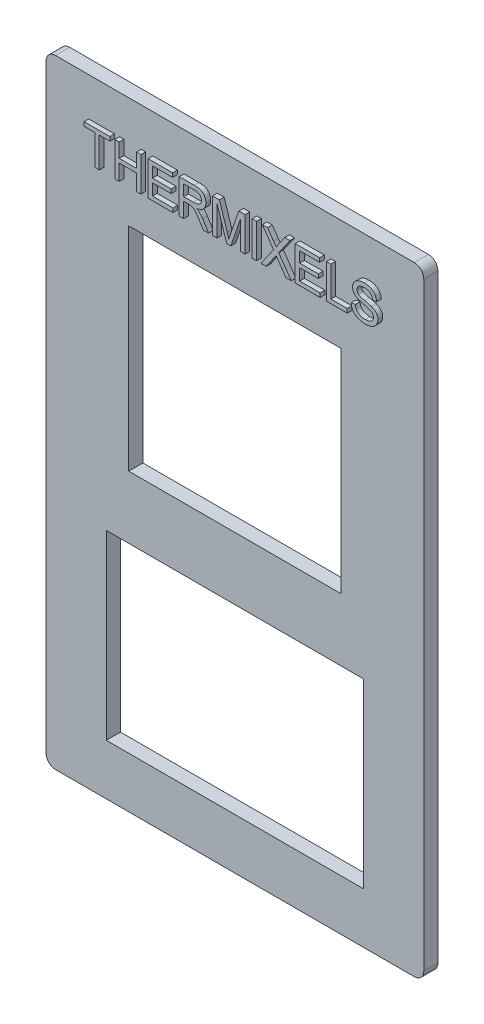
from build123d import *

# Parameters (mm, degrees)
SKETCH1_W           = 80
SKETCH1_H           = 131
SKETCH1_W_2         = 45
SKETCH1_H_2         = 45
SKETCH1_W_3         = 54.5
SKETCH1_H_3         = 38.5
BOSS_EXTRUDE1_DEPTH = 3
SKETCH2_W           = 0.941558442
SKETCH2_H           = 7.25
BOSS_EXTRUDE2_DEPTH = 1
FILLET1_R           = 2


with BuildPart() as part:
    # Sketch1 → Boss-Extrude1 (new body)
    with BuildSketch(Plane.XY):
        with Locations((40, 65.5)):
            Rectangle(SKETCH1_W, SKETCH1_H)
        with Locations((40, 85)):
            Rectangle(SKETCH1_W_2, SKETCH1_H_2, mode=Mode.SUBTRACT)
        with Locations((40, 30)):
            Rectangle(SKETCH1_W_3, SKETCH1_H_3, mode=Mode.SUBTRACT)
    extrude(amount=BOSS_EXTRUDE1_DEPTH)

    # Sketch2 → Boss-Extrude2 (add)
    # profile 1 of 10: a face of its own
    with BuildSketch(Plane.XY.offset(3)):
        Polygon((11.313135408, 115.625), (11.313135408, 122.027597403), (9.053395148, 122.027597403), (9.053395148, 122.875), (14.514434109, 122.875), (14.514434109, 122.027597403), (12.254693849, 122.027597403), (12.254693849, 115.625), align=None)
    # profile 2 of 10: a face of its own
    with BuildSketch(Plane.XY.offset(3)):
        Polygon((15.550148395, 115.625), (15.550148395, 122.875), (16.491706836, 122.875), (16.491706836, 119.862012987), (20.163784758, 119.862012987), (20.163784758, 122.875), (21.1053432, 122.875), (21.1053432, 115.625), (20.163784758, 115.625), (20.163784758, 119.01461039), (16.491706836, 119.01461039), (16.491706836, 115.625), align=None)
    # profile 3 of 10: a face of its own
    with BuildSketch(Plane.XY.offset(3)):
        Polygon((22.611836706, 115.625), (22.611836706, 122.875), (27.790408135, 122.875), (27.790408135, 122.027597403), (23.553395148, 122.027597403), (23.553395148, 119.767857143), (27.507940603, 119.767857143), (27.507940603, 118.920454545), (23.553395148, 118.920454545), (23.553395148, 116.472402597), (27.884563979, 116.472402597), (27.884563979, 115.625), align=None)
    # profile 4 of 10: a face of its own
    with BuildSketch(Plane.XY.offset(3)):
        with BuildLine():
            Line((29.202745797, 115.625), (29.202745797, 122.875))
            Line((29.202745797, 122.875), (32.336369986, 122.875))
            add(Edge.make_bspline(
                [(32.336369986, 122.875), (32.415336241, 122.874602612), (32.568437832, 122.873832148), (32.789716649, 122.863199873), (32.995291083, 122.847074214), (33.184490929, 122.826114805), (33.357685473, 122.796190369), (33.514545114, 122.761674794), (33.655985454, 122.720801194), (33.82183071, 122.656308753), (34.011369632, 122.55524165), (34.217224196, 122.40071533), (34.398971082, 122.209028701), (34.558679598, 121.987863894), (34.689761441, 121.739707682), (34.78440633, 121.469152962), (34.841431574, 121.179142079), (34.848485244, 120.979393902), (34.852096447, 120.877130682)],
                knots=[0, 0, 0, 0, 1.030544332, 1.998043051, 2.890480458, 3.721695405, 4.481404597, 5.183263541, 5.817161953, 6.400757953, 7.50313325, 8.609125791, 9.745318953, 10.937272591, 12.159766252, 13.39456301, 14.666118619, 16, 16, 16, 16], degree=3))
            add(Edge.make_bspline(
                [(34.852096447, 120.877130682), (34.850878894, 120.809379798), (34.848497722, 120.676879226), (34.824117737, 120.48292724), (34.785434685, 120.29888362), (34.727967971, 120.125077427), (34.658726792, 119.95998509), (34.570351593, 119.805660484), (34.467377381, 119.660766081), (34.34729021, 119.526869078), (34.213787663, 119.403076588), (34.064528058, 119.291763291), (33.901330769, 119.1921966), (33.72368519, 119.103606478), (33.532359455, 119.027044423), (33.325817908, 118.964419465), (33.105864621, 118.910925085), (32.952997363, 118.886081301), (32.874823719, 118.873376623)],
                knots=[0, 0, 0, 0, 1.04266252, 2.039137685, 3.004725552, 3.933568567, 4.853623551, 5.756445818, 6.665780382, 7.585649453, 8.520732132, 9.464553523, 10.447433731, 11.46044915, 12.517636968, 13.616238581, 14.780986072, 16, 16, 16, 16], degree=3))
            add(Edge.make_bspline(
                [(32.874823719, 118.873376623), (32.933067193, 118.846163831), (33.043243048, 118.794686946), (33.194496006, 118.710006913), (33.32486613, 118.626170358), (33.40005293, 118.564126927), (33.435345229, 118.535004058)],
                knots=[0, 0, 0, 0, 1.173923048, 2.22064321, 3.164779041, 4, 4, 4, 4], degree=3))
            add(Edge.make_bspline(
                [(33.435345229, 118.535004058), (33.503922314, 118.464223571), (33.641293629, 118.322438473), (33.831300043, 118.094708576), (34.01308525, 117.858295766), (34.121074074, 117.690848482), (34.175351317, 117.606686282)],
                knots=[0, 0, 0, 0, 0.993850212, 1.990847395, 2.990161568, 4, 4, 4, 4], degree=3))
            Line((34.175351317, 117.606686282), (35.417031512, 115.625))
            Line((35.417031512, 115.625), (34.329825749, 115.625))
            Line((34.329825749, 115.625), (33.354430051, 117.157974838))
            add(Edge.make_bspline(
                [(33.354430051, 117.157974838), (33.309164487, 117.229794325), (33.222196663, 117.367779672), (33.091720766, 117.562645274), (32.973915122, 117.740943343), (32.863111899, 117.89858641), (32.761872159, 118.037140059), (32.669315475, 118.156489579), (32.585884658, 118.257063939), (32.48795532, 118.36239132), (32.37332754, 118.471818831), (32.235769109, 118.579997499), (32.101168893, 118.666936579), (31.962170192, 118.729928429), (31.812376501, 118.775299789), (31.64098675, 118.804678839), (31.444289208, 118.823867673), (31.304141313, 118.825457885), (31.230038817, 118.826298701)],
                knots=[0, 0, 0, 0, 1.418723887, 2.725765865, 3.919146964, 4.990070291, 5.945749833, 6.786767125, 7.513978839, 8.12871761, 9.189652849, 10.15862938, 11.04997554, 11.860530317, 12.700508675, 13.658610017, 14.762001805, 16, 16, 16, 16], degree=3))
            Line((31.230038817, 118.826298701), (30.144304239, 118.826298701))
            Line((30.144304239, 118.826298701), (30.144304239, 115.625))
            Line((30.144304239, 115.625), (29.202745797, 115.625))
        make_face()
        with BuildLine():
            Line((30.144304239, 119.673701299), (32.162770148, 119.673701299))
            add(Edge.make_bspline(
                [(32.162770148, 119.673701299), (32.216235157, 119.67368473), (32.31978961, 119.67365264), (32.470359705, 119.681912656), (32.611113494, 119.692155297), (32.741962827, 119.70398759), (32.861937348, 119.724256925), (32.972604157, 119.745652969), (33.073587827, 119.771455773), (33.192813394, 119.812725225), (33.328455665, 119.875288762), (33.474983293, 119.96942469), (33.603615942, 120.082916695), (33.712720118, 120.214429892), (33.801368143, 120.361435115), (33.86526178, 120.521830003), (33.902661496, 120.693979724), (33.90787184, 120.812215255), (33.910538005, 120.872717127)],
                knots=[0, 0, 0, 0, 1.066902271, 2.06644462, 3.00855671, 3.884103054, 4.687051012, 5.43566476, 6.133616419, 6.765054694, 7.951788473, 9.105614668, 10.228940449, 11.361819756, 12.503249853, 13.641023194, 14.792896602, 16, 16, 16, 16], degree=3))
            add(Edge.make_bspline(
                [(33.910538005, 120.872717127), (33.90941328, 120.916409365), (33.907217321, 121.001715881), (33.88992151, 121.126320316), (33.85775823, 121.243078424), (33.818113014, 121.354282237), (33.761835596, 121.456594802), (33.696384477, 121.552755339), (33.616583392, 121.639998892), (33.527230674, 121.721426166), (33.424708141, 121.793489466), (33.311091618, 121.857262326), (33.184828478, 121.909497293), (33.04795817, 121.954626641), (32.898579514, 121.984973407), (32.738775792, 122.011143482), (32.567116249, 122.02544529), (32.448693611, 122.026867059), (32.387861463, 122.027597403)],
                knots=[0, 0, 0, 0, 0.968665341, 1.891261876, 2.780051154, 3.650494894, 4.501781516, 5.361360086, 6.22368492, 7.116720453, 8.036879137, 8.995792874, 9.999462667, 11.061951851, 12.185865212, 13.374597422, 14.651365327, 16, 16, 16, 16], degree=3))
            Line((32.387861463, 122.027597403), (30.144304239, 122.027597403))
            Line((30.144304239, 122.027597403), (30.144304239, 119.673701299))
        make_face(mode=Mode.SUBTRACT)
    # profile 5 of 10: a face of its own
    with BuildSketch(Plane.XY.offset(3)):
        with BuildLine():
            Line((36.264434109, 115.625), (36.264434109, 122.875))
            Line((36.264434109, 122.875), (37.707666658, 122.875))
            Line((37.707666658, 122.875), (39.368634596, 117.742035308))
            Line((39.368634596, 117.742035308), (39.701122421, 116.668070211))
            add(Edge.make_bspline(
                [(39.701122421, 116.668070211), (39.712289762, 116.703414912), (39.735744973, 116.777650789), (39.775183272, 116.894310964), (39.814778074, 117.023635733), (39.863016899, 117.162695025), (39.912614253, 117.313549583), (39.967257262, 117.475311272), (40.026045495, 117.648931208), (40.066926363, 117.768527071), (40.088044093, 117.830306412)],
                knots=[0, 0, 0, 0, 0.726206643, 1.525280629, 2.41254226, 3.3756825, 4.408698438, 5.523752133, 6.720850731, 8, 8, 8, 8], degree=3))
            Line((40.088044093, 117.830306412), (41.828456025, 122.875))
            Line((41.828456025, 122.875), (43.137810732, 122.875))
            Line((43.137810732, 122.875), (43.137810732, 115.625))
            Line((43.137810732, 115.625), (42.196252291, 115.625))
            Line((42.196252291, 115.625), (42.196252291, 121.661272321))
            Line((42.196252291, 121.661272321), (40.12776609, 115.625))
            Line((40.12776609, 115.625), (39.256824531, 115.625))
            Line((39.256824531, 115.625), (37.205992551, 122.008471997))
            Line((37.205992551, 122.008471997), (37.205992551, 115.625))
            Line((37.205992551, 115.625), (36.264434109, 115.625))
        make_face()
    # profile 6 of 10: a face of its own
    with BuildSketch(Plane.XY.offset(3)):
        with Locations((45.11508346, 119.25)):
            Rectangle(SKETCH2_W, SKETCH2_H)
    # profile 7 of 10: a face of its own
    with BuildSketch(Plane.XY.offset(3)):
        with BuildLine():
            Line((46.527421122, 115.625), (49.179967794, 119.455965909))
            Line((49.179967794, 119.455965909), (46.809888655, 122.875))
            Line((46.809888655, 122.875), (47.908863898, 122.875))
            Line((47.908863898, 122.875), (49.181438979, 121.036018669))
            add(Edge.make_bspline(
                [(49.181438979, 121.036018669), (49.213342001, 120.989940469), (49.274746974, 120.901251985), (49.362973174, 120.772887413), (49.444669535, 120.655542428), (49.521522549, 120.549745423), (49.586038084, 120.450814704), (49.646772666, 120.363794731), (49.70144185, 120.288148662), (49.734204102, 120.240170678), (49.749316414, 120.218039773)],
                knots=[0, 0, 0, 0, 1.350735487, 2.599812571, 3.753970439, 4.796795366, 5.750702226, 6.59986529, 7.35415694, 8, 8, 8, 8], degree=3))
            add(Edge.make_bspline(
                [(49.749316414, 120.218039773), (49.783205056, 120.276663782), (49.854275063, 120.39960789), (49.975241634, 120.587553739), (50.107921817, 120.791883179), (50.204052475, 120.931307765), (50.253932892, 121.003652597)],
                knots=[0, 0, 0, 0, 0.869878114, 1.824276277, 2.871057297, 4, 4, 4, 4], degree=3))
            Line((50.253932892, 121.003652597), (51.548575749, 122.875))
            Line((51.548575749, 122.875), (52.647550992, 122.875))
            Line((52.647550992, 122.875), (50.277471853, 119.455965909))
            Line((50.277471853, 119.455965909), (52.930018525, 115.625))
            Line((52.930018525, 115.625), (51.832514466, 115.625))
            Line((51.832514466, 115.625), (50.022956836, 118.23635349))
            add(Edge.make_bspline(
                [(50.022956836, 118.23635349), (49.97343338, 118.307955621), (49.875392114, 118.449705898), (49.777275113, 118.591403764), (49.728719823, 118.661525974)],
                knots=[0, 0, 0, 0, 1.010257365, 2, 2, 2, 2], degree=3))
            add(Edge.make_bspline(
                [(49.728719823, 118.661525974), (49.689904824, 118.605671862), (49.61848718, 118.50290311), (49.521548352, 118.361221034), (49.442413678, 118.247083458), (49.395746798, 118.179954436), (49.375635408, 118.151024756)],
                knots=[0, 0, 0, 0, 1.314943104, 2.419429103, 3.318842897, 4, 4, 4, 4], degree=3))
            Line((49.375635408, 118.151024756), (47.624925181, 115.625))
            Line((47.624925181, 115.625), (46.527421122, 115.625))
        make_face()
    # profile 8 of 10: a face of its own
    with BuildSketch(Plane.XY.offset(3)):
        Polygon((53.777421122, 115.625), (53.777421122, 122.875), (58.955992551, 122.875), (58.955992551, 122.027597403), (54.718979564, 122.027597403), (54.718979564, 119.767857143), (58.673525018, 119.767857143), (58.673525018, 118.920454545), (54.718979564, 118.920454545), (54.718979564, 116.472402597), (59.050148395, 116.472402597), (59.050148395, 115.625), align=None)
    # profile 9 of 10: a face of its own
    with BuildSketch(Plane.XY.offset(3)):
        Polygon((60.368330213, 115.625), (60.368330213, 122.875), (61.309888655, 122.875), (61.309888655, 116.472402597), (64.793654888, 116.472402597), (64.793654888, 115.625), align=None)
    # profile 10 of 10: a face of its own
    with BuildSketch(Plane.XY.offset(3)):
        with BuildLine():
            Line((65.641057486, 117.978896104), (66.488460083, 118.073051948))
            add(Edge.make_bspline(
                [(66.488460083, 118.073051948), (66.502071541, 117.977030675), (66.527964896, 117.794367444), (66.597268903, 117.5394022), (66.687629878, 117.316645725), (66.804214712, 117.124990282), (66.948791973, 116.961535569), (67.116674596, 116.816303704), (67.311444278, 116.688286903), (67.530070429, 116.576765146), (67.770396427, 116.487474109), (68.028199153, 116.424969293), (68.30024698, 116.385697323), (68.486682819, 116.380766522), (68.581956431, 116.378246753)],
                knots=[0, 0, 0, 0, 1.162815379, 2.212047466, 3.161707124, 4.038726961, 4.889553997, 5.769726749, 6.695101972, 7.679354139, 8.708998216, 9.763694405, 10.857189086, 12, 12, 12, 12], degree=3))
            add(Edge.make_bspline(
                [(68.581956431, 116.378246753), (68.650161501, 116.37938035), (68.782356945, 116.381577495), (68.974862733, 116.398423139), (69.155628612, 116.423380731), (69.324186077, 116.463161619), (69.482781552, 116.508272892), (69.627767285, 116.569545858), (69.762391955, 116.638711661), (69.883973884, 116.719469073), (69.992740526, 116.808939749), (70.087990023, 116.905488224), (70.169650366, 117.007936117), (70.234267937, 117.118508294), (70.287540712, 117.233707516), (70.321466799, 117.357069622), (70.345050349, 117.486130266), (70.347565346, 117.574697719), (70.348849694, 117.619926948)],
                knots=[0, 0, 0, 0, 1.35233248, 2.621098287, 3.83001208, 4.967128563, 6.053240012, 7.095311951, 8.082721221, 9.051028926, 9.9836646, 10.870772999, 11.736515156, 12.573768008, 13.405183114, 14.24542405, 15.103981045, 16, 16, 16, 16], degree=3))
            add(Edge.make_bspline(
                [(70.348849694, 117.619926948), (70.347004459, 117.672078791), (70.343401328, 117.773914028), (70.311213863, 117.921656314), (70.260196556, 118.059523026), (70.186609519, 118.186460648), (70.092552091, 118.302243642), (69.97819356, 118.407430416), (69.842011965, 118.500368395), (69.711592478, 118.569212092), (69.58669856, 118.621170253), (69.467935091, 118.664849661), (69.32462161, 118.711825203), (69.157183251, 118.761296612), (68.96588407, 118.814209087), (68.750359261, 118.869736022), (68.511221954, 118.930309155), (68.34318998, 118.970212466), (68.255353346, 118.991071429)],
                knots=[0, 0, 0, 0, 0.916104664, 1.788848314, 2.645769488, 3.49186081, 4.356514409, 5.259742896, 6.214213058, 7.248052071, 7.847074344, 8.591965525, 9.472809354, 10.498705084, 11.661979767, 12.962989187, 14.412440187, 16, 16, 16, 16], degree=3))
            add(Edge.make_bspline(
                [(68.255353346, 118.991071429), (68.176313856, 119.010352765), (68.023770594, 119.047565023), (67.804162223, 119.106891324), (67.601118372, 119.164747622), (67.415913391, 119.225400432), (67.247266968, 119.285310102), (67.096138132, 119.346833816), (66.961632736, 119.40869823), (66.806272592, 119.489322561), (66.635103996, 119.602232681), (66.452942013, 119.754266859), (66.29400931, 119.922643438), (66.161000223, 120.107613855), (66.05338384, 120.306734616), (65.978735125, 120.521335505), (65.931169875, 120.748026397), (65.92610099, 120.903861616), (65.923525018, 120.983056006)],
                knots=[0, 0, 0, 0, 1.164454861, 2.247354366, 3.255881247, 4.1859514, 5.036323886, 5.81710277, 6.520605073, 7.154828166, 8.320995384, 9.447097958, 10.544550058, 11.625719254, 12.699664114, 13.771956115, 14.867723368, 16, 16, 16, 16], degree=3))
            add(Edge.make_bspline(
                [(65.923525018, 120.983056006), (65.925471481, 121.054270612), (65.929302843, 121.194447407), (65.960516794, 121.399898811), (66.013646732, 121.595294894), (66.087941311, 121.780025033), (66.180813346, 121.955540615), (66.296658209, 122.119951164), (66.435014137, 122.272726252), (66.59047076, 122.41675821), (66.763300029, 122.548320561), (66.954621596, 122.659241261), (67.158779615, 122.755493845), (67.377076102, 122.835485819), (67.610838349, 122.895273273), (67.858902552, 122.937066016), (68.121353299, 122.964526694), (68.301378618, 122.967587254), (68.393644742, 122.969155844)],
                knots=[0, 0, 0, 0, 0.960256834, 1.890142101, 2.795180156, 3.685719122, 4.570540281, 5.46793153, 6.390802793, 7.34571353, 8.323378249, 9.313760082, 10.322787061, 11.364900047, 12.444646488, 13.572360775, 14.755792447, 16, 16, 16, 16], degree=3))
            add(Edge.make_bspline(
                [(68.393644742, 122.969155844), (68.519339957, 122.966187069), (68.763873513, 122.96041147), (69.118638381, 122.911728514), (69.449129872, 122.829234247), (69.754499656, 122.715551445), (70.031052939, 122.569126217), (70.277782122, 122.396005553), (70.489873378, 122.190909755), (70.638205184, 121.997607498), (70.740664137, 121.831493455), (70.8062036, 121.700012499), (70.864570862, 121.564377693), (70.911177709, 121.422368382), (70.949402096, 121.275416444), (70.978696701, 121.123090545), (71.000114219, 120.965453785), (71.005305681, 120.858072634), (71.007940603, 120.803571429)],
                knots=[0, 0, 0, 0, 1.583974498, 3.081540673, 4.502860407, 5.87030138, 7.178281716, 8.437285517, 9.657023653, 10.882341282, 11.498312504, 12.114810821, 12.732516653, 13.358060341, 13.996782451, 14.645389409, 15.312468632, 16, 16, 16, 16], degree=3))
            Line((71.007940603, 120.803571429), (70.160538005, 120.709415584))
            add(Edge.make_bspline(
                [(70.160538005, 120.709415584), (70.153532815, 120.767412703), (70.139859044, 120.88062009), (70.105918569, 121.043436086), (70.062312751, 121.195612314), (70.005000223, 121.334952509), (69.936407462, 121.462704867), (69.859257768, 121.579955062), (69.767792188, 121.683795912), (69.666332974, 121.776794306), (69.55332054, 121.857956065), (69.43023296, 121.929121259), (69.296231675, 121.989467629), (69.151064755, 122.037445013), (68.995797623, 122.076336575), (68.8292929, 122.101691621), (68.652419301, 122.118330065), (68.530995692, 122.120592206), (68.468675181, 122.121753247)],
                knots=[0, 0, 0, 0, 1.131756525, 2.209130438, 3.219617986, 4.195638117, 5.122576386, 6.026723669, 6.909180997, 7.797199498, 8.688821757, 9.600084306, 10.548695315, 11.531494245, 12.559572992, 13.647086039, 14.792369936, 16, 16, 16, 16], degree=3))
            add(Edge.make_bspline(
                [(68.468675181, 122.121753247), (68.405382605, 122.121074773), (68.282536278, 122.119757904), (68.104159244, 122.104793601), (67.937377584, 122.080422322), (67.782243136, 122.044493779), (67.637953254, 122.001621163), (67.505555128, 121.946460474), (67.384830639, 121.881897045), (67.275764359, 121.808553319), (67.179203683, 121.726984838), (67.09565051, 121.638925624), (67.023801095, 121.545676523), (66.965862476, 121.445636642), (66.920268336, 121.339986312), (66.887659074, 121.228369604), (66.867978699, 121.111263377), (66.866060429, 121.031192042), (66.86508346, 120.990411932)],
                knots=[0, 0, 0, 0, 1.378201176, 2.674989139, 3.895506129, 5.04591762, 6.140586707, 7.170055899, 8.164005682, 9.117895186, 10.027336126, 10.911268581, 11.757215555, 12.58523919, 13.422510946, 14.257326553, 15.112461219, 16, 16, 16, 16], degree=3))
            add(Edge.make_bspline(
                [(66.86508346, 120.990411932), (66.865865528, 120.952606586), (66.867384012, 120.879202691), (66.880969531, 120.772855781), (66.902419915, 120.672938049), (66.93565637, 120.580298777), (66.975136727, 120.492680223), (67.02357913, 120.411028035), (67.082681439, 120.337398307), (67.127935661, 120.29407088), (67.150493362, 120.27247362)],
                knots=[0, 0, 0, 0, 1.138015241, 2.209601583, 3.223566131, 4.209060914, 5.167289295, 6.114529505, 7.060156606, 8, 8, 8, 8], degree=3))
            add(Edge.make_bspline(
                [(67.150493362, 120.27247362), (67.177923631, 120.250619186), (67.237709176, 120.20298643), (67.347451762, 120.143084897), (67.478703762, 120.080783124), (67.635405359, 120.021292715), (67.815837255, 119.963326244), (68.019936615, 119.905735495), (68.248334969, 119.850376965), (68.409256488, 119.815552038), (68.493685327, 119.797280844)],
                knots=[0, 0, 0, 0, 0.585146858, 1.275354783, 2.081874102, 3.013294601, 4.073280169, 5.248527622, 6.556416687, 8, 8, 8, 8], degree=3))
            add(Edge.make_bspline(
                [(68.493685327, 119.797280844), (68.576598312, 119.779797316), (68.736227727, 119.746136901), (68.965806762, 119.694867283), (69.175932655, 119.644250806), (69.367764612, 119.59838254), (69.539495986, 119.550627131), (69.69208219, 119.506761169), (69.826132635, 119.466367205), (69.907619545, 119.436229323), (69.945744986, 119.422128653)],
                knots=[0, 0, 0, 0, 1.354960269, 2.608656721, 3.761262021, 4.811096771, 5.762257901, 6.611034033, 7.350141775, 8, 8, 8, 8], degree=3))
            add(Edge.make_bspline(
                [(69.945744986, 119.422128653), (69.998026006, 119.401227827), (70.100425818, 119.360290588), (70.246672675, 119.288282785), (70.385419409, 119.213179325), (70.512955376, 119.128196569), (70.633448485, 119.040241122), (70.744179508, 118.944295122), (70.844989796, 118.841119103), (70.938630391, 118.733952324), (71.021073238, 118.620099078), (71.093878253, 118.500979336), (71.153573081, 118.375293079), (71.204651019, 118.245371874), (71.242308616, 118.109134255), (71.270573643, 117.968095045), (71.286763765, 117.821364251), (71.289179565, 117.721967331), (71.290408135, 117.671418425)],
                knots=[0, 0, 0, 0, 1.143595362, 2.239894117, 3.31030232, 4.34668468, 5.351103288, 6.340031211, 7.319425495, 8.280243859, 9.228947196, 10.172245371, 11.112591778, 12.052621374, 13.005241214, 13.980368408, 14.972904105, 16, 16, 16, 16], degree=3))
            add(Edge.make_bspline(
                [(71.290408135, 117.671418425), (71.289225031, 117.620859064), (71.286887226, 117.520954059), (71.269770777, 117.372545477), (71.244381577, 117.227639902), (71.205271173, 117.086045708), (71.155019044, 116.948794837), (71.096307202, 116.813501532), (71.025177783, 116.682273289), (70.916062219, 116.513168498), (70.757297278, 116.316109641), (70.534130909, 116.107840444), (70.278927, 115.93024532), (70.042498374, 115.810661834), (69.84034437, 115.728432328), (69.678480098, 115.675833377), (69.508812538, 115.632024022), (69.332046423, 115.595349454), (69.148037411, 115.565667024), (68.956027227, 115.545229782), (68.756190422, 115.533681347), (68.620221938, 115.531800731), (68.551061544, 115.530844156)],
                knots=[0, 0, 0, 0, 0.778525382, 1.53836165, 2.298348054, 3.042251481, 3.797229868, 4.54800306, 5.311733262, 6.093184067, 7.645483155, 9.195189299, 10.779191089, 12.417471056, 13.264598258, 14.138768214, 15.036408913, 15.96220544, 16.918314263, 17.905856232, 18.93481339, 20, 20, 20, 20], degree=3))
            add(Edge.make_bspline(
                [(68.551061544, 115.530844156), (68.444078214, 115.532729069), (68.235040976, 115.536412045), (67.930124, 115.567776714), (67.641769528, 115.618802051), (67.369981983, 115.690838012), (67.114582541, 115.783174269), (66.876108751, 115.897090209), (66.654252486, 116.031517984), (66.449910798, 116.185552834), (66.265910619, 116.357617849), (66.104128777, 116.544946008), (65.967719271, 116.748941948), (65.85476489, 116.966707612), (65.763637896, 117.198758082), (65.698222126, 117.445582955), (65.65457604, 117.707234707), (65.645629454, 117.887020363), (65.641057486, 117.978896104)],
                knots=[0, 0, 0, 0, 1.201459697, 2.347560271, 3.438871862, 4.487749606, 5.501931785, 6.485000003, 7.451429773, 8.411006407, 9.354125374, 10.276028933, 11.185055718, 12.104041828, 13.026718527, 13.979440501, 14.967434866, 16, 16, 16, 16], degree=3))
        make_face()
    extrude(amount=BOSS_EXTRUDE2_DEPTH)

    # Fillet1
    fillet1_edges = [part.edges().sort_by_distance(p)[0] for p in [
        (0, 131, 1.5),
        (80, 131, 1.5),
        (80, 0, 1.5),
        (0, 0, 1.5),
    ]]
    fillet(fillet1_edges, radius=FILLET1_R)


solid = part.part
